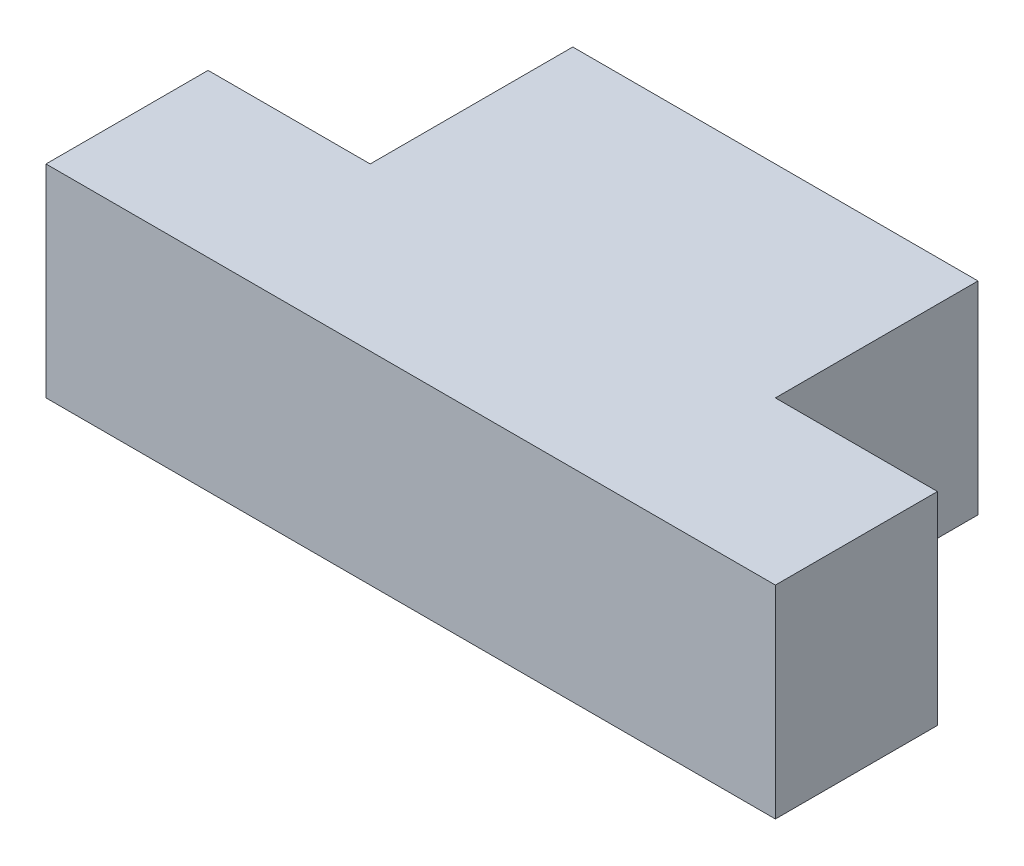
from build123d import *

# Parameters (mm, degrees)
EXTRUDE_1_DEPTH = 2.5


with BuildPart() as part:
    # 草图1 → 凸台-拉伸1 (new body)
    with BuildSketch(Plane(origin=(0, 0, 0), x_dir=(1, 0, 0), z_dir=(0, 1, 0))):
        Polygon((-3.158730159, -1.619047619), (5.841269841, -1.619047619), (5.841269841, 0.380952381), (3.841269841, 0.380952381), (3.841269841, 2.880952381), (-1.158730159, 2.880952381), (-1.158730159, 0.380952381), (-3.158730159, 0.380952381), align=None)
    extrude(amount=EXTRUDE_1_DEPTH)


solid = part.part
